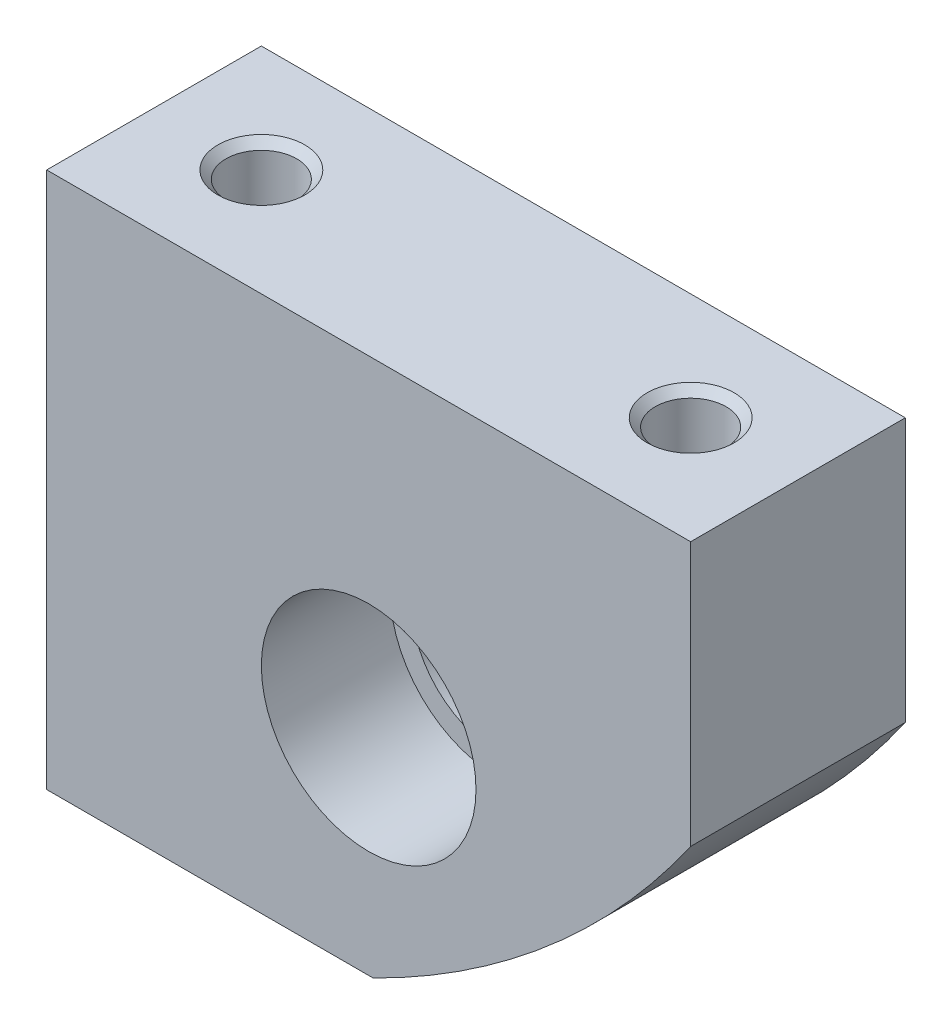
from build123d import *

# Parameters (mm, degrees)
SKIZZE1_W                       = 30
SKIZZE1_H                       = 25
SKIZZE1_R                       = 4
AUFSATZ_LINEAR_AUSTRAGEN1_DEPTH = 10
SKIZZE2_R                       = 5
SCHNITT_LINEAR_AUSTRAGEN1_DEPTH = 6
SKIZZE3_R                       = 1
SCHNITT_LINEAR_AUSTRAGEN2_DEPTH = 16
M4_GEWINDEBOHRUNG1_D            = 3.3
M4_GEWINDEBOHRUNG1_DEPTH        = 11.5
M4_GEWINDEBOHRUNG1_CSINK_D      = 4.05
M4_GEWINDEBOHRUNG1_CSINK_ANGLE  = 90
M4_GEWINDEBOHRUNG1_TIP          = 0.991420021
SKIZZE5_R                       = 51.207337477
SKIZZE5_R_2                     = 39
SCHNITT_LINEAR_AUSTRAGEN3_DEPTH = 10


with BuildPart() as part:
    # Skizze1 → Aufsatz-Linear austragen1 (new body)
    with BuildSketch(Plane.XY):
        with Locations((-3.885739266, 7.64084507)):
            Rectangle(SKIZZE1_W, SKIZZE1_H)
        with Locations((-3.885739266, 5.14084507)):
            Circle(SKIZZE1_R, mode=Mode.SUBTRACT)
    extrude(amount=AUFSATZ_LINEAR_AUSTRAGEN1_DEPTH)

    # Skizze2 → Schnitt-Linear austragen1 (cut)
    with BuildSketch(Plane.XY.offset(10)):
        with Locations((-3.885739266, 5.14084507)):
            Circle(SKIZZE2_R)
    extrude(amount=-SCHNITT_LINEAR_AUSTRAGEN1_DEPTH, mode=Mode.SUBTRACT)

    # Skizze3 → Schnitt-Linear austragen2 (cut)
    with BuildSketch(Plane(origin=(0, 20.14084507, 0), x_dir=(1, 0, 0), z_dir=(0, 1, 0))):
        with Locations(Location((-13.885739266, -5, 0), (0, 0, 270))):
            Circle(SKIZZE3_R)
        with Locations(Location((6.114260734, -5, 0), (0, 0, 270))):
            Circle(SKIZZE3_R)
    extrude(amount=-SCHNITT_LINEAR_AUSTRAGEN2_DEPTH, mode=Mode.SUBTRACT)

    # M4 Gewindebohrung1
    with Locations(Plane(origin=(-13.885739266, 20.14084507, 5), x_dir=(0, 0, 1), z_dir=(0, 1, 0))):
        with Locations((0, 0), (0, 20)):
            CounterSinkHole(M4_GEWINDEBOHRUNG1_D / 2, M4_GEWINDEBOHRUNG1_CSINK_D / 2, depth=M4_GEWINDEBOHRUNG1_DEPTH, counter_sink_angle=M4_GEWINDEBOHRUNG1_CSINK_ANGLE)
            with Locations((0, 0, -(M4_GEWINDEBOHRUNG1_DEPTH + M4_GEWINDEBOHRUNG1_TIP / 2))):  # 118° drill point
                Cone(0, M4_GEWINDEBOHRUNG1_D / 2, M4_GEWINDEBOHRUNG1_TIP, mode=Mode.SUBTRACT)

    # Skizze5 → Schnitt-Linear austragen3 (cut)
    with BuildSketch(Plane.XY.offset(10)):
        with Locations((-20.885739266, 30.14084507)):
            Circle(SKIZZE5_R)
        with Locations((-20.885739266, 30.14084507)):
            Circle(SKIZZE5_R_2, mode=Mode.SUBTRACT)
    extrude(amount=-SCHNITT_LINEAR_AUSTRAGEN3_DEPTH, mode=Mode.SUBTRACT)


solid = part.part
